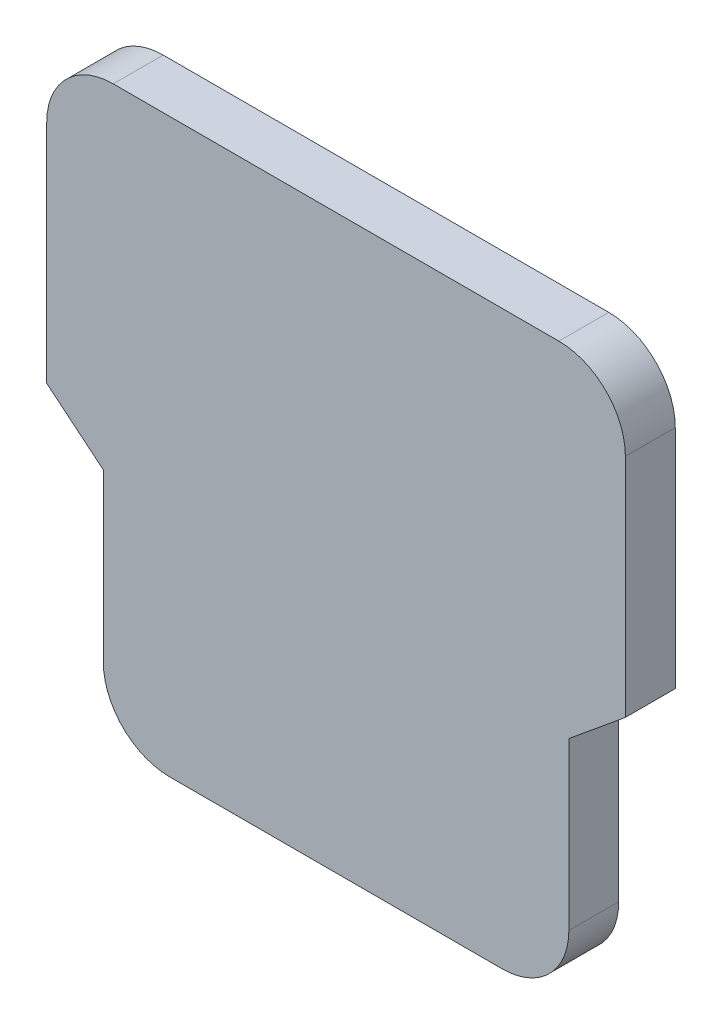
from build123d import *

# Parameters (mm, degrees)
DODANIE_WYCI_GNI_CIE1_DEPTH = 1.5
ZAOKR_GLENIE2_R             = 2


with BuildPart() as part:
    # Szkic1 → Dodanie-wyciągnięcie1 (new body)
    with BuildSketch(Plane.XY):
        Polygon((-10.154625861, 12.792384106), (7.245374139, 12.792384106), (7.245374139, 3.992384106), (5.545374139, 2.592384106), (5.545374139, -4.407615894), (-8.454625861, -4.407615894), (-8.454625861, 2.592384106), (-10.154625861, 3.992384106), align=None)
    extrude(amount=DODANIE_WYCI_GNI_CIE1_DEPTH)

    # Zaokrąglenie2
    zaokr_glenie2_edges = [part.edges().sort_by_distance(p)[0] for p in [
        (-10.154625861, 12.792384106, 0.75),
        (7.245374139, 12.792384106, 0.75),
        (5.545374139, -4.407615894, 0.75),
        (-8.454625861, -4.407615894, 0.75),
    ]]
    fillet(zaokr_glenie2_edges, radius=ZAOKR_GLENIE2_R)


solid = part.part
